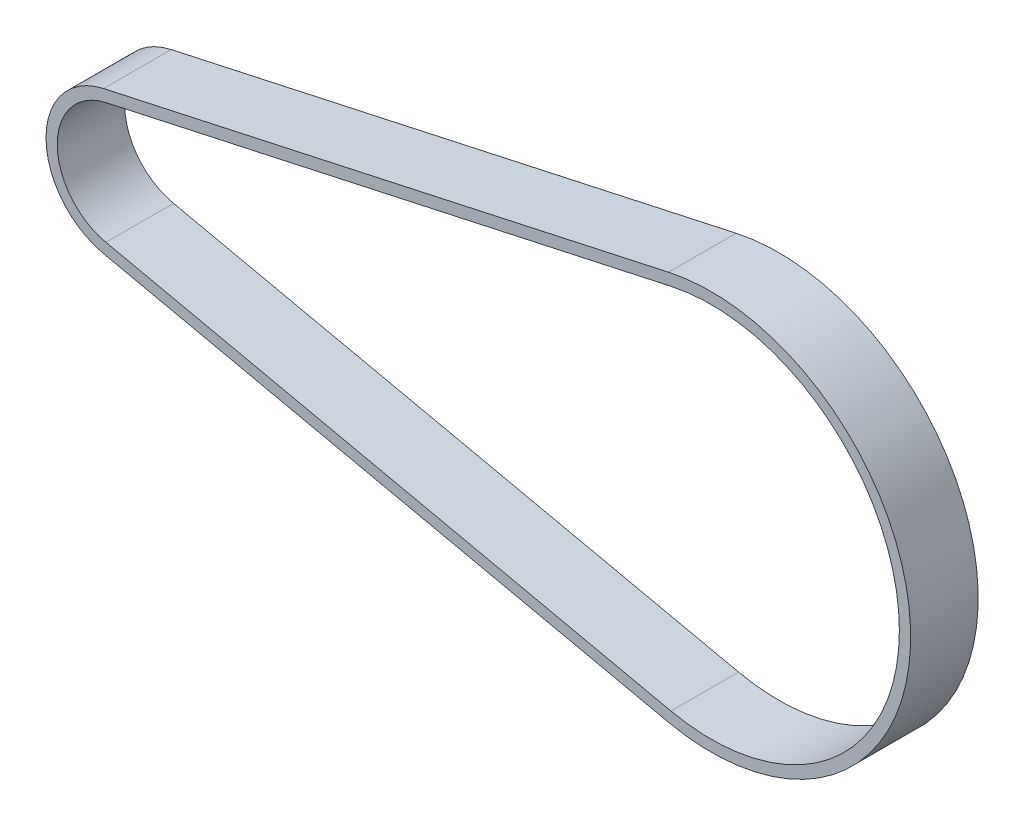
from build123d import *

# Parameters (mm, degrees)
SALIENTE_EXTRUIR1_DEPTH = 6


with BuildPart() as part:
    # Croquis1 → Saliente-Extruir1 (new body)
    with BuildSketch(Plane.XY):
        with BuildLine():
            Line((-1.387161198, 6.350258562), (48.793385164, 17.311781804))
            ThreePointArc((48.793385164, 17.311781804), (70.295, 0), (48.793385164, -17.311781804))
            Line((48.793385164, -17.311781804), (-1.387161198, -6.350258562))
            ThreePointArc((-1.387161198, -6.350258562), (-6.5, 0), (-1.387161198, 6.350258562))
        make_face()
        with BuildLine():
            Line((-1.173751783, 5.373295707), (49.006794579, 16.334818948))
            ThreePointArc((49.006794579, 16.334818948), (69.295, 0), (49.006794579, -16.334818948))
            Line((49.006794579, -16.334818948), (-1.173751783, -5.373295707))
            ThreePointArc((-1.173751783, -5.373295707), (-5.5, 0), (-1.173751783, 5.373295707))
        make_face(mode=Mode.SUBTRACT)
    extrude(amount=SALIENTE_EXTRUIR1_DEPTH)


solid = part.part
